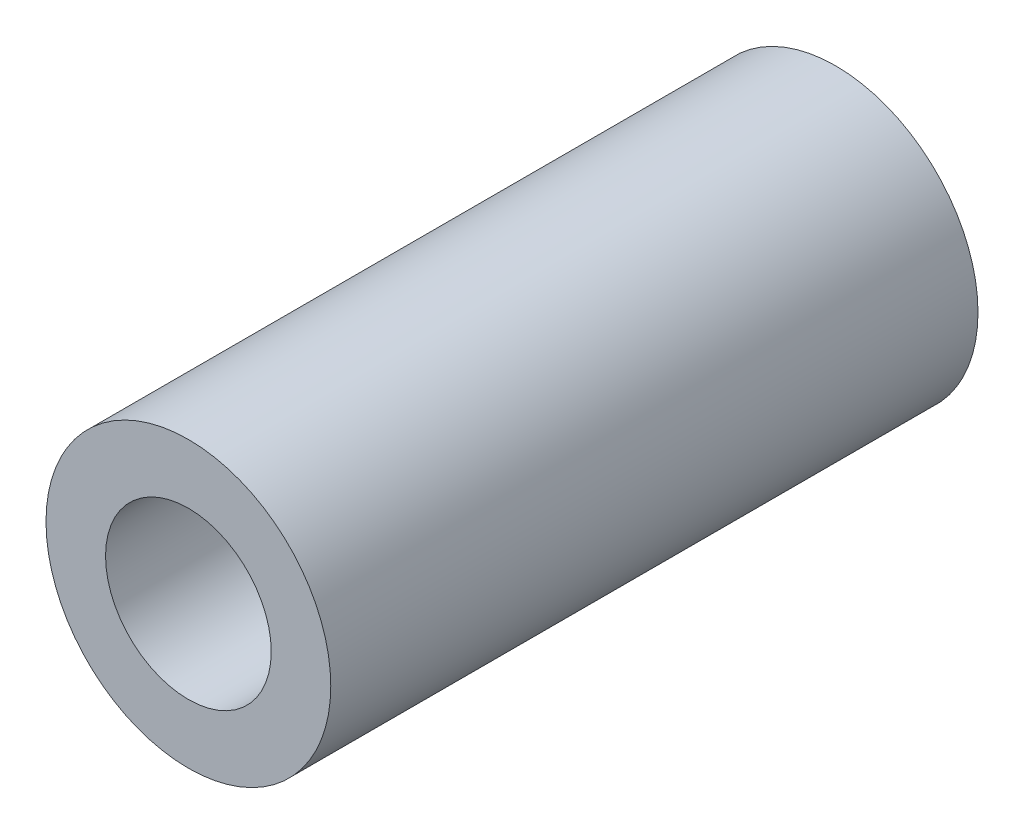
from build123d import *

# Parameters (mm, degrees)
SKETCH_1_R      = 2.75
SKETCH_1_R_2    = 1.6
EXTRUDE_1_DEPTH = 12.5


with BuildPart() as part:
    # ｽｹｯﾁ1 → ﾎﾞｽ - 押し出し1 (new body)
    with BuildSketch(Plane.XY):
        Circle(SKETCH_1_R)
        Circle(SKETCH_1_R_2, mode=Mode.SUBTRACT)
    extrude(amount=EXTRUDE_1_DEPTH)


solid = part.part
